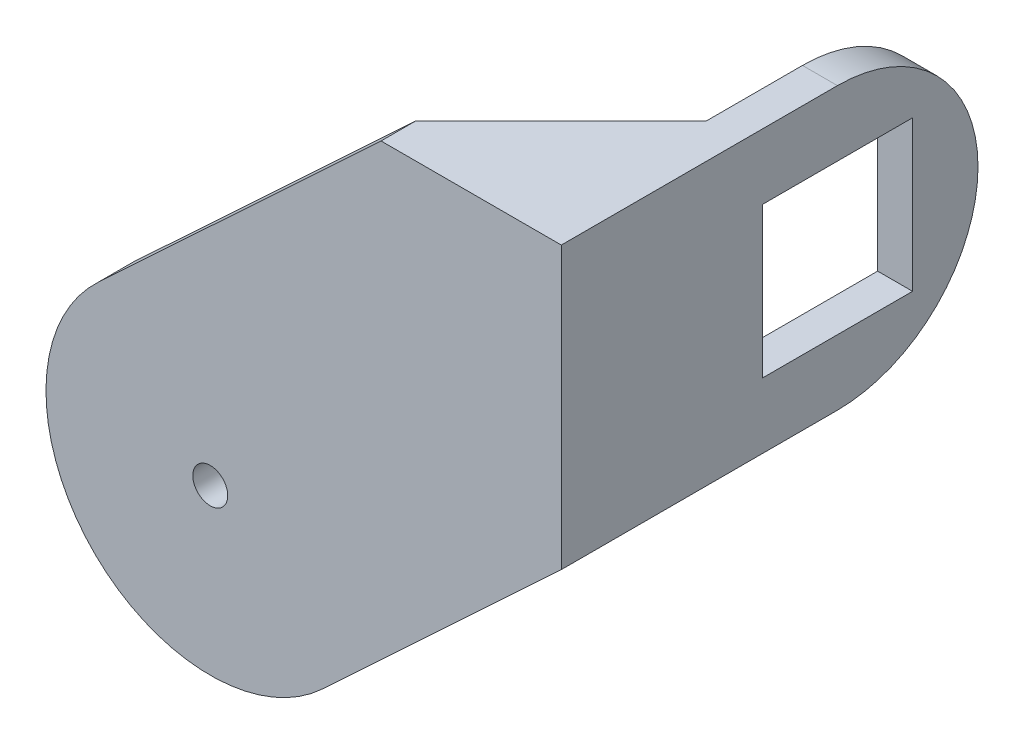
from build123d import *

# Parameters (mm, degrees)
SKETCH2_R           = 5
BOSS_EXTRUDE1_DEPTH = 10
SKETCH5_W           = 43
SKETCH5_H           = 43
BOSS_EXTRUDE3_DEPTH = 10
BOSS_EXTRUDE4_DEPTH = 10


with BuildPart() as part:
    # Sketch2 → Boss-Extrude1 (new body)
    with BuildSketch(Plane.XY):
        with BuildLine():
            Line((790.019647556, 783.678215824), (709.10700943, 708.225960112))
            ThreePointArc((709.10700943, 708.225960112), (706.787308377, 641.798413213), (773.214855276, 639.47871216))
            Line((773.214855276, 639.47871216), (841.59626274, 703.245406232))
            Line((841.59626274, 703.245406232), (841.59626274, 783.678215824))
            Line((841.59626274, 783.678215824), (790.019647556, 783.678215824))
        make_face()
        with Locations((741.160932353, 673.852336136)):
            Circle(SKETCH2_R, mode=Mode.SUBTRACT)
    extrude(amount=BOSS_EXTRUDE1_DEPTH)

    # Sketch5 → Boss-Extrude3 (add)
    with BuildSketch(Plane(origin=(841.59626274, 0, 0), x_dir=(0, 0, -1), z_dir=(1, 0, 0))):
        with BuildLine():
            Line((69, 783.678215824), (0, 783.678215824))
            Line((0, 783.678215824), (0, 703.245406232))
            Line((0, 703.245406232), (69, 703.245406232))
            ThreePointArc((69, 703.245406232), (109.216404796, 743.461811028), (69, 783.678215824))
        make_face()
        with Locations((69, 743.461811028)):
            Rectangle(SKETCH5_W, SKETCH5_H, mode=Mode.SUBTRACT)
    extrude(amount=-BOSS_EXTRUDE3_DEPTH)

    # Sketch6 → Boss-Extrude4 (add)
    with BuildSketch(Plane(origin=(0, 783.678215824, 0), x_dir=(1, 0, 0), z_dir=(0, 1, 0))):
        Polygon((790.019647556, 0), (831.59626274, 41.576615184), (831.59626274, 0), align=None)
    boss_extrude4 = extrude(amount=-BOSS_EXTRUDE4_DEPTH)

    # Mirror1: Boss-Extrude4 across plane
    add(boss_extrude4.mirror(Plane.ZX.offset(743.461811028)))


solid = part.part
